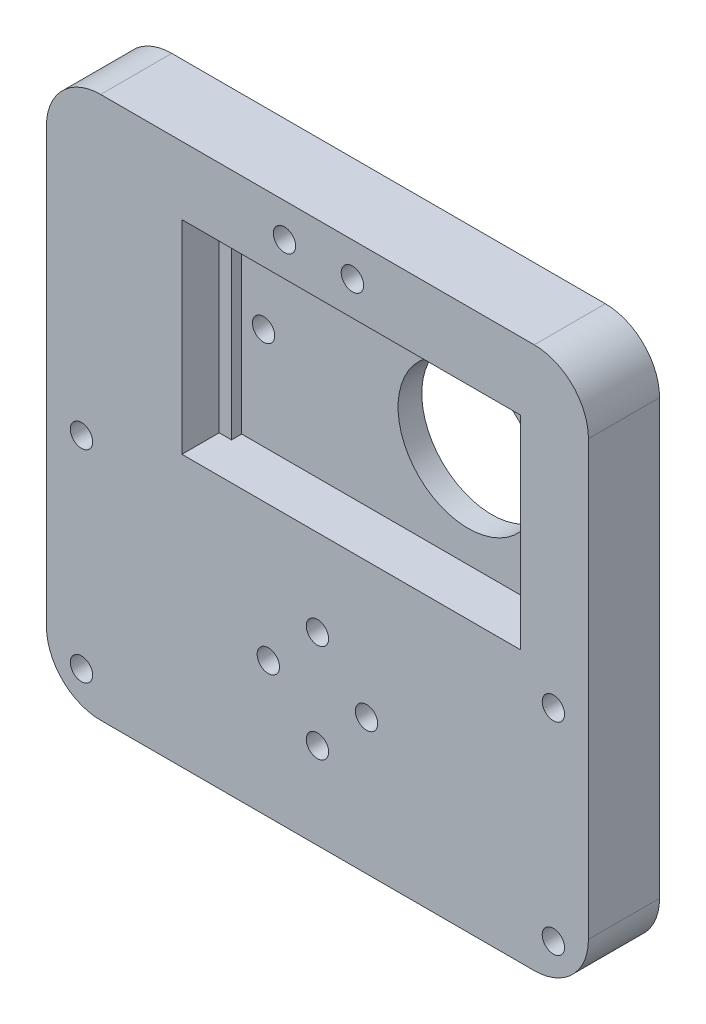
from build123d import *

# Parameters (mm, degrees)
SKETCH_1_W          = 80
SKETCH_1_H          = 80
EXTRUDE_1_DEPTH     = 10.5
SKETCH_3_R          = 10.35
SKETCH_3_R_2        = 1.65
CUT_EXTRUDE_1_DEPTH = 62.116691664
SKETCH_2_W          = 50
SKETCH_2_H          = 30
CUT_EXTRUDE_2_DEPTH = 5.5
SKETCH_6_W          = 45.255083204
SKETCH_6_H          = 30
CUT_EXTRUDE_3_DEPTH = 7
SKETCH_7_R          = 1.65
CUT_EXTRUDE_4_DEPTH = 62.116691664
FILLET_1_R          = 8
FILLET_2_R          = 8
FILLET_3_R          = 8
FILLET_4_R          = 8
SKETCH_9_R          = 1.65
CUT_EXTRUDE_5_DEPTH = 62.116691664


with BuildPart() as part:
    # 草图1 → 凸台-拉伸1 (new body)
    with BuildSketch(Plane.XY):
        with Locations((-5, 0)):
            Rectangle(SKETCH_1_W, SKETCH_1_H)
    extrude(amount=EXTRUDE_1_DEPTH)

    # 草图3 → 切除-拉伸1 (cut, through all)
    with BuildSketch(Plane.XY.offset(10.5)):
        with Locations((10.25, 15)):
            Circle(SKETCH_3_R)
        with Locations((-19.95, 15)):
            Circle(SKETCH_3_R_2)
        with Locations((-9.86238383, 35)):
            Circle(SKETCH_3_R_2)
        with Locations((0.16238383, 35)):
            Circle(SKETCH_3_R_2)
    extrude(amount=-CUT_EXTRUDE_1_DEPTH, mode=Mode.SUBTRACT)

    # 草图2 → 切除-拉伸2 (cut)
    with BuildSketch(Plane.XY.offset(10.5)):
        with Locations((0, 15)):
            Rectangle(SKETCH_2_W, SKETCH_2_H)
    extrude(amount=-CUT_EXTRUDE_2_DEPTH, mode=Mode.SUBTRACT)

    # 草图6 → 切除-拉伸3 (cut)
    with BuildSketch(Plane.XY.offset(10.5)):
        with Locations((-0.553390963, 15)):
            Rectangle(SKETCH_6_W, SKETCH_6_H)
    extrude(amount=-CUT_EXTRUDE_3_DEPTH, mode=Mode.SUBTRACT)

    # 草图7 → 切除-拉伸4 (cut, through all)
    with BuildSketch(Plane.XY.offset(10.5)):
        with Locations((-5, -12.75)):
            Circle(SKETCH_7_R)
        with Locations((2.25, -20)):
            Circle(SKETCH_7_R)
        with Locations((-5, -27.25)):
            Circle(SKETCH_7_R)
        with Locations((-12.25, -20)):
            Circle(SKETCH_7_R)
    extrude(amount=-CUT_EXTRUDE_4_DEPTH, mode=Mode.SUBTRACT)

    # 圆角1
    fillet_1_edges = [part.edges().sort_by_distance(p)[0] for p in [
        (-45, -40, 5.25),
    ]]
    fillet(fillet_1_edges, radius=FILLET_1_R)

    # 圆角2
    fillet_2_edges = [part.edges().sort_by_distance(p)[0] for p in [
        (35, -40, 5.25),
    ]]
    fillet(fillet_2_edges, radius=FILLET_2_R)

    # 圆角3
    fillet_3_edges = [part.edges().sort_by_distance(p)[0] for p in [
        (35, 40, 5.25),
    ]]
    fillet(fillet_3_edges, radius=FILLET_3_R)

    # 圆角4
    fillet_4_edges = [part.edges().sort_by_distance(p)[0] for p in [
        (-45, 40, 5.25),
    ]]
    fillet(fillet_4_edges, radius=FILLET_4_R)

    # 草图9 → 切除-拉伸5 (cut, through all)
    with BuildSketch(Plane(origin=(0, 0, 0), x_dir=(-1, 0, 0), z_dir=(0, 0, -1))):
        with Locations((-29.828427125, -34.828427125)):
            Circle(SKETCH_9_R)
        with Locations((39.828427125, -34.828427125)):
            Circle(SKETCH_9_R)
        with Locations((-29.828427125, -5)):
            Circle(SKETCH_9_R)
        with Locations((39.828427125, -5)):
            Circle(SKETCH_9_R)
    extrude(amount=-CUT_EXTRUDE_5_DEPTH, mode=Mode.SUBTRACT)


solid = part.part
